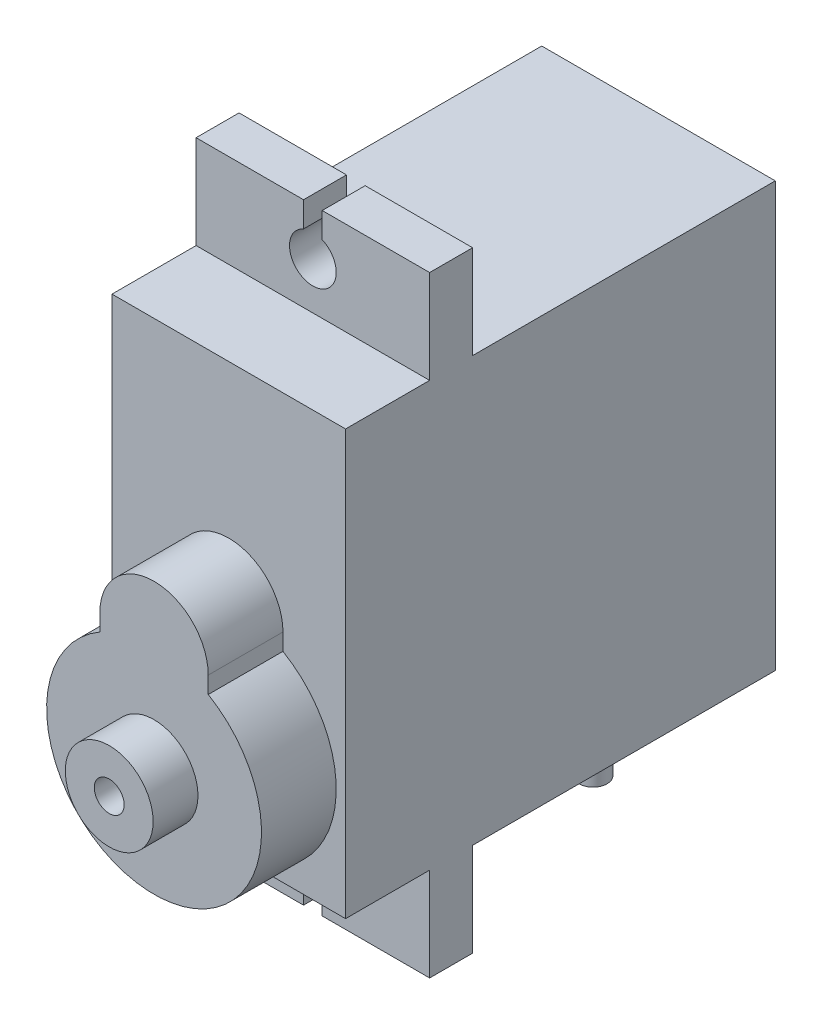
from build123d import *

# Parameters (mm, degrees)
SKETCH1_W           = 12.5
SKETCH1_H           = 22.7
BOSS_EXTRUDE1_DEPTH = 23
BOSS_EXTRUDE2_DEPTH = 4
SKETCH3_W           = 2.3
SKETCH3_H           = 5
BOSS_EXTRUDE3_DEPTH = 6.25
CUT_EXTRUDE1_REACH  = 27.468
BOSS_EXTRUDE4_START = -4
SKETCH5_W           = 4
SKETCH5_H           = 5
BOSS_EXTRUDE4_DEPTH = 1.5
SKETCH6_R           = 2.35
SKETCH6_R_2         = 0.8
BOSS_EXTRUDE5_DEPTH = 2.4
SKETCH7_W           = 4.514706964
SKETCH7_H           = 2.103718672
CUT_EXTRUDE2_DEPTH  = 5


with BuildPart() as part:
    # Sketch1 → Boss-Extrude1 (new body)
    with BuildSketch(Plane.XY):
        Rectangle(SKETCH1_W, SKETCH1_H)
    extrude(amount=BOSS_EXTRUDE1_DEPTH)

    # Sketch2 → Boss-Extrude2 (add)
    with BuildSketch(Plane.XY.offset(23)):
        with BuildLine():
            Line((2.9, 0.265128397), (2.9, -0.634871603))
            ThreePointArc((2.9, -0.634871603), (0, -11.35), (-2.9, -0.634871603))
            Line((-2.9, -0.634871603), (-2.9, 0.265128397))
            ThreePointArc((-2.9, 0.265128397), (0, 3.165128397), (2.9, 0.265128397))
        make_face()
    extrude(amount=BOSS_EXTRUDE2_DEPTH)

    # Sketch3 → Boss-Extrude3 (add, symmetric)
    with BuildSketch(Plane(origin=(0, 0, 0), x_dir=(0, 0, -1), z_dir=(1, 0, 0))):
        with Locations((-17.35, 13.85)):
            Rectangle(SKETCH3_W, SKETCH3_H)
        with Locations((-17.35, -13.85)):
            Rectangle(SKETCH3_W, SKETCH3_H)
    extrude(amount=BOSS_EXTRUDE3_DEPTH, both=True)

    # Sketch4 → Cut-Extrude1 (cut, up to next)
    with BuildSketch(Plane.XY.offset(18.5), mode=Mode.PRIVATE) as cut_extrude1_sk1:
        with BuildLine():
            Line((0.5, 16.35), (-0.5, 16.35))
            Line((-0.5, 16.35), (-0.5, 14.995643924))
            ThreePointArc((-0.5, 14.995643924), (0, 12.6), (0.5, 14.995643924))
            Line((0.5, 14.995643924), (0.5, 16.35))
        make_face()
    cut_extrude1_tool1 = extrude(cut_extrude1_sk1.sketch, amount=-CUT_EXTRUDE1_REACH, mode=Mode.PRIVATE) & part.part
    # Sketch4 → Cut-Extrude1 (cut, up to next)
    with BuildSketch(Plane.XY.offset(18.5), mode=Mode.PRIVATE) as cut_extrude1_sk2:
        with BuildLine():
            Line((-0.5, -16.35), (-0.5, -14.995643924))
            ThreePointArc((-0.5, -14.995643924), (0, -12.6), (0.5, -14.995643924))
            Line((0.5, -14.995643924), (0.5, -16.35))
            Line((0.5, -16.35), (-0.5, -16.35))
        make_face()
    cut_extrude1_tool2 = extrude(cut_extrude1_sk2.sketch, amount=-CUT_EXTRUDE1_REACH, mode=Mode.PRIVATE) & part.part
    add(cut_extrude1_tool1.solids().sort_by_distance((0, 14.235184, 18.5))[0], mode=Mode.SUBTRACT)
    add(cut_extrude1_tool2.solids().sort_by_distance((0, -14.235184, 18.5))[0], mode=Mode.SUBTRACT)

    # Sketch5 → Boss-Extrude4 (add)
    with BuildSketch(Plane(origin=(0, 0, 0), x_dir=(-1, 0, 0), z_dir=(0, 0, -1)).offset(BOSS_EXTRUDE4_START)):
        with Locations((0, -13.85)):
            Rectangle(SKETCH5_W, SKETCH5_H)
    extrude(amount=-BOSS_EXTRUDE4_DEPTH)

    # Sketch6 → Boss-Extrude5 (add)
    with BuildSketch(Plane.XY.offset(27)):
        with Locations((0, -5.6)):
            Circle(SKETCH6_R)
        with Locations((0, -5.6)):
            Circle(SKETCH6_R_2, mode=Mode.SUBTRACT)
    extrude(amount=BOSS_EXTRUDE5_DEPTH)

    # Sketch7 → Cut-Extrude2 (cut)
    with BuildSketch(Plane.XZ.offset(16.35)):
        with Locations((0, 4.75)):
            Rectangle(SKETCH7_W, SKETCH7_H)
        with BuildLine():
            ThreePointArc((-0.625, 4.335421901), (-2, 4.75), (-0.625, 5.164578099))
            ThreePointArc((-0.625, 5.164578099), (0, 5.5), (0.625, 5.164578099))
            ThreePointArc((0.625, 5.164578099), (2, 4.75), (0.625, 4.335421901))
            ThreePointArc((0.625, 4.335421901), (0, 4), (-0.625, 4.335421901))
        make_face(mode=Mode.SUBTRACT)
    extrude(amount=-CUT_EXTRUDE2_DEPTH, mode=Mode.SUBTRACT)


solid = part.part
